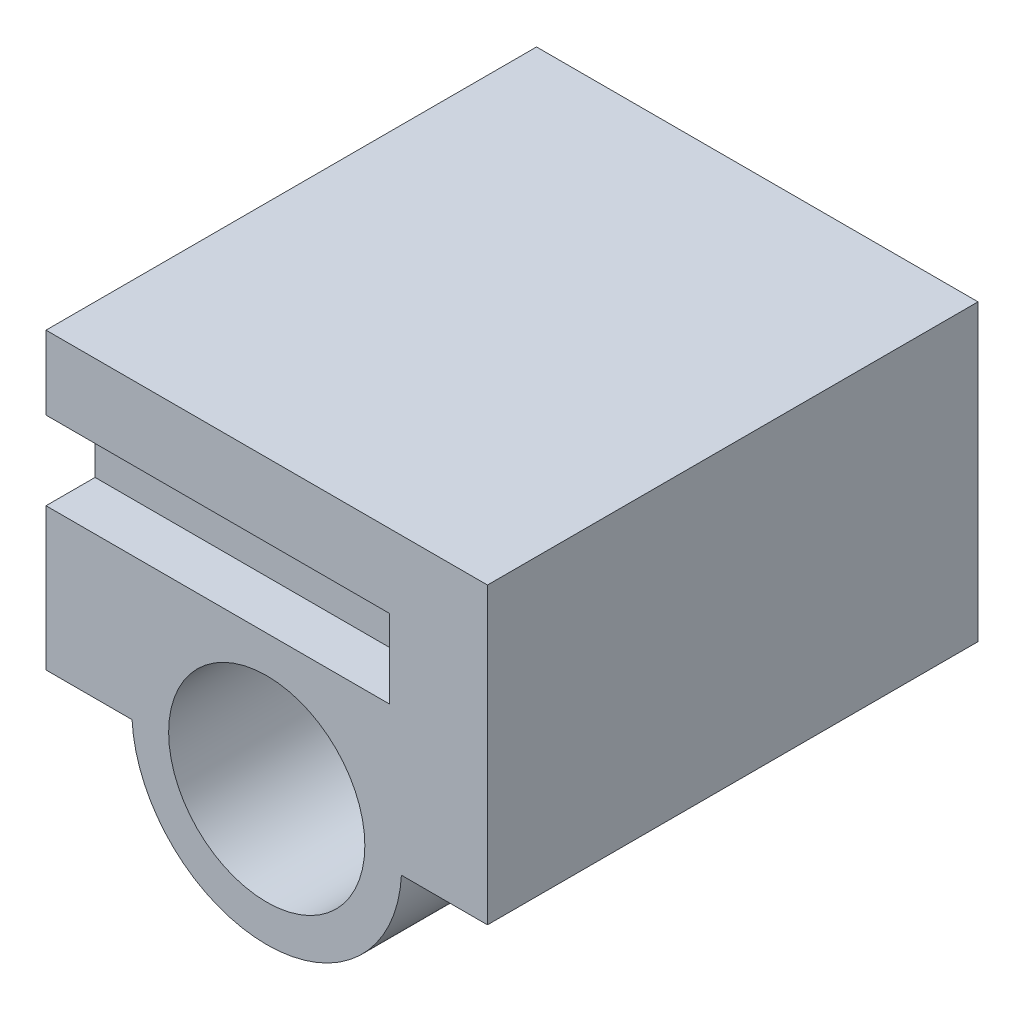
from build123d import *

# Parameters (mm, degrees)
SKETCH1_W           = 9
SKETCH1_H           = 6
BOSS_EXTRUDE1_DEPTH = 10
CUT_EXTRUDE1_START  = -2
SKETCH2_W           = 10
SKETCH2_H           = 1.6
CUT_EXTRUDE1_DEPTH  = 7
SKETCH3_R           = 2.75
BOSS_EXTRUDE2_DEPTH = 10
SKETCH4_R           = 2
CUT_EXTRUDE2_DEPTH  = 4
BOSS_EXTRUDE3_REACH = 16.573


with BuildPart() as part:
    # Sketch1 → Boss-Extrude1 (new body)
    with BuildSketch(Plane.XY):
        Rectangle(SKETCH1_W, SKETCH1_H)
    extrude(amount=BOSS_EXTRUDE1_DEPTH)

    # Sketch2 → Cut-Extrude1 (cut)
    with BuildSketch(Plane(origin=(4.5, 0, 0), x_dir=(0, 0, -1), z_dir=(1, 0, 0)).offset(CUT_EXTRUDE1_START)):
        with Locations((-5, 0.7)):
            Rectangle(SKETCH2_W, SKETCH2_H)
    extrude(amount=-CUT_EXTRUDE1_DEPTH, mode=Mode.SUBTRACT)

    # Sketch3 → Boss-Extrude2 (add, through all)
    with BuildSketch(Plane.XY.offset(10)):
        with Locations((0, -2.85)):
            Circle(SKETCH3_R)
    extrude(amount=-BOSS_EXTRUDE2_DEPTH)

    # Sketch4 → Cut-Extrude2 (cut)
    with BuildSketch(Plane.XY.offset(10)):
        with Locations((0, -2.85)):
            Circle(SKETCH4_R)
    extrude(amount=-CUT_EXTRUDE2_DEPTH, mode=Mode.SUBTRACT)

    # Sketch5 → Boss-Extrude3 (add, up to next)
    with BuildSketch(Plane.ZY.offset(4.5), mode=Mode.PRIVATE) as boss_extrude3_sk1:
        with BuildLine():
            Line((0, -0.1), (1, -0.1))
            Line((1, -0.1), (1, 0.65))
            ThreePointArc((1, 0.65), (0.956066017, 0.756066017), (0.85, 0.8))
            Line((0.85, 0.8), (0.15, 0.8))
            ThreePointArc((0.15, 0.8), (0.043933983, 0.756066017), (0, 0.65))
            Line((0, 0.65), (0, -0.1))
        make_face()
    boss_extrude3_tool1 = extrude(boss_extrude3_sk1.sketch, amount=-BOSS_EXTRUDE3_REACH, mode=Mode.PRIVATE) - part.part
    # Sketch5 → Boss-Extrude3 (add, up to next)
    with BuildSketch(Plane.ZY.offset(4.5), mode=Mode.PRIVATE) as boss_extrude3_sk2:
        with BuildLine():
            Line((2, -0.1), (2, 0.65))
            ThreePointArc((2, 0.65), (2.043933983, 0.756066017), (2.15, 0.8))
            Line((2.15, 0.8), (2.85, 0.8))
            ThreePointArc((2.85, 0.8), (2.956066017, 0.756066017), (3, 0.65))
            Line((3, 0.65), (3, -0.1))
            Line((3, -0.1), (2, -0.1))
        make_face()
    boss_extrude3_tool2 = extrude(boss_extrude3_sk2.sketch, amount=-BOSS_EXTRUDE3_REACH, mode=Mode.PRIVATE) - part.part
    # Sketch5 → Boss-Extrude3 (add, up to next)
    with BuildSketch(Plane.ZY.offset(4.5), mode=Mode.PRIVATE) as boss_extrude3_sk3:
        with BuildLine():
            Line((4, -0.1), (4, 0.65))
            ThreePointArc((4, 0.65), (4.043933983, 0.756066017), (4.15, 0.8))
            Line((4.15, 0.8), (4.85, 0.8))
            ThreePointArc((4.85, 0.8), (4.956066017, 0.756066017), (5, 0.65))
            Line((5, 0.65), (5, -0.1))
            Line((5, -0.1), (4, -0.1))
        make_face()
    boss_extrude3_tool3 = extrude(boss_extrude3_sk3.sketch, amount=-BOSS_EXTRUDE3_REACH, mode=Mode.PRIVATE) - part.part
    # Sketch5 → Boss-Extrude3 (add, up to next)
    with BuildSketch(Plane.ZY.offset(4.5), mode=Mode.PRIVATE) as boss_extrude3_sk4:
        with BuildLine():
            Line((6, -0.1), (6, 0.65))
            ThreePointArc((6, 0.65), (6.043933983, 0.756066017), (6.15, 0.8))
            Line((6.15, 0.8), (6.85, 0.8))
            ThreePointArc((6.85, 0.8), (6.956066017, 0.756066017), (7, 0.65))
            Line((7, 0.65), (7, -0.1))
            Line((7, -0.1), (6, -0.1))
        make_face()
    boss_extrude3_tool4 = extrude(boss_extrude3_sk4.sketch, amount=-BOSS_EXTRUDE3_REACH, mode=Mode.PRIVATE) - part.part
    # Sketch5 → Boss-Extrude3 (add, up to next)
    with BuildSketch(Plane.ZY.offset(4.5), mode=Mode.PRIVATE) as boss_extrude3_sk5:
        with BuildLine():
            Line((8, -0.1), (8, 0.65))
            ThreePointArc((8, 0.65), (8.043933983, 0.756066017), (8.15, 0.8))
            Line((8.15, 0.8), (8.85, 0.8))
            ThreePointArc((8.85, 0.8), (8.956066017, 0.756066017), (9, 0.65))
            Line((9, 0.65), (9, -0.1))
            Line((9, -0.1), (8, -0.1))
        make_face()
    boss_extrude3_tool5 = extrude(boss_extrude3_sk5.sketch, amount=-BOSS_EXTRUDE3_REACH, mode=Mode.PRIVATE) - part.part
    add(boss_extrude3_tool1.solids().sort_by_distance((-4.5, 0.345482, 0.5))[0])
    add(boss_extrude3_tool2.solids().sort_by_distance((-4.5, 0.345482, 2.5))[0])
    add(boss_extrude3_tool3.solids().sort_by_distance((-4.5, 0.345482, 4.5))[0])
    add(boss_extrude3_tool4.solids().sort_by_distance((-4.5, 0.345482, 6.5))[0])
    add(boss_extrude3_tool5.solids().sort_by_distance((-4.5, 0.345482, 8.5))[0])


solid = part.part
